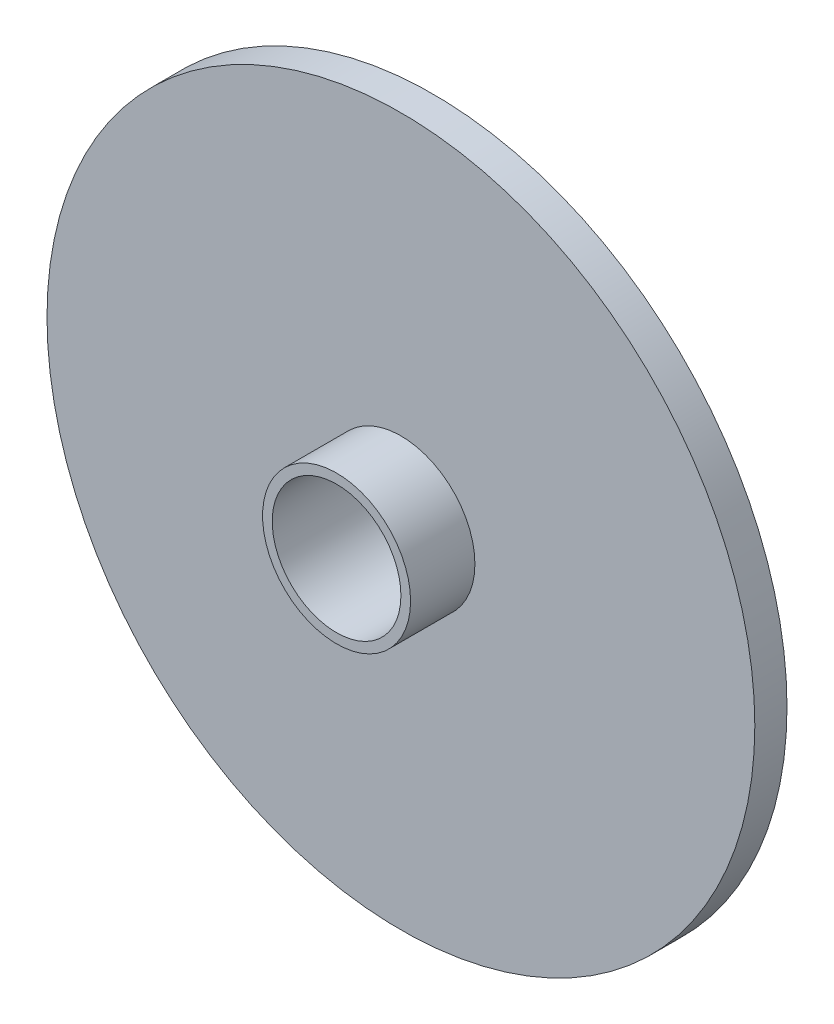
from build123d import *

# Parameters (mm, degrees)
SKETCH1_R           = 55
BOSS_EXTRUDE1_DEPTH = 5
SKETCH2_R           = 11.5
SKETCH2_R_2         = 10
BOSS_EXTRUDE2_DEPTH = 10
SKETCH3_R           = 10
CUT_EXTRUDE1_DEPTH  = 79.421935707


with BuildPart() as part:
    # Sketch1 → Boss-Extrude1 (new body)
    with BuildSketch(Plane.XY):
        Circle(SKETCH1_R)
    extrude(amount=BOSS_EXTRUDE1_DEPTH)

    # Sketch2 → Boss-Extrude2 (add)
    with BuildSketch(Plane.XY.offset(5)):
        Circle(SKETCH2_R)
        Circle(SKETCH2_R_2, mode=Mode.SUBTRACT)
    extrude(amount=BOSS_EXTRUDE2_DEPTH)

    # Sketch3 → Cut-Extrude1 (cut, through all)
    with BuildSketch(Plane.XY.offset(5)):
        Circle(SKETCH3_R)
    extrude(amount=-CUT_EXTRUDE1_DEPTH, mode=Mode.SUBTRACT)


solid = part.part
